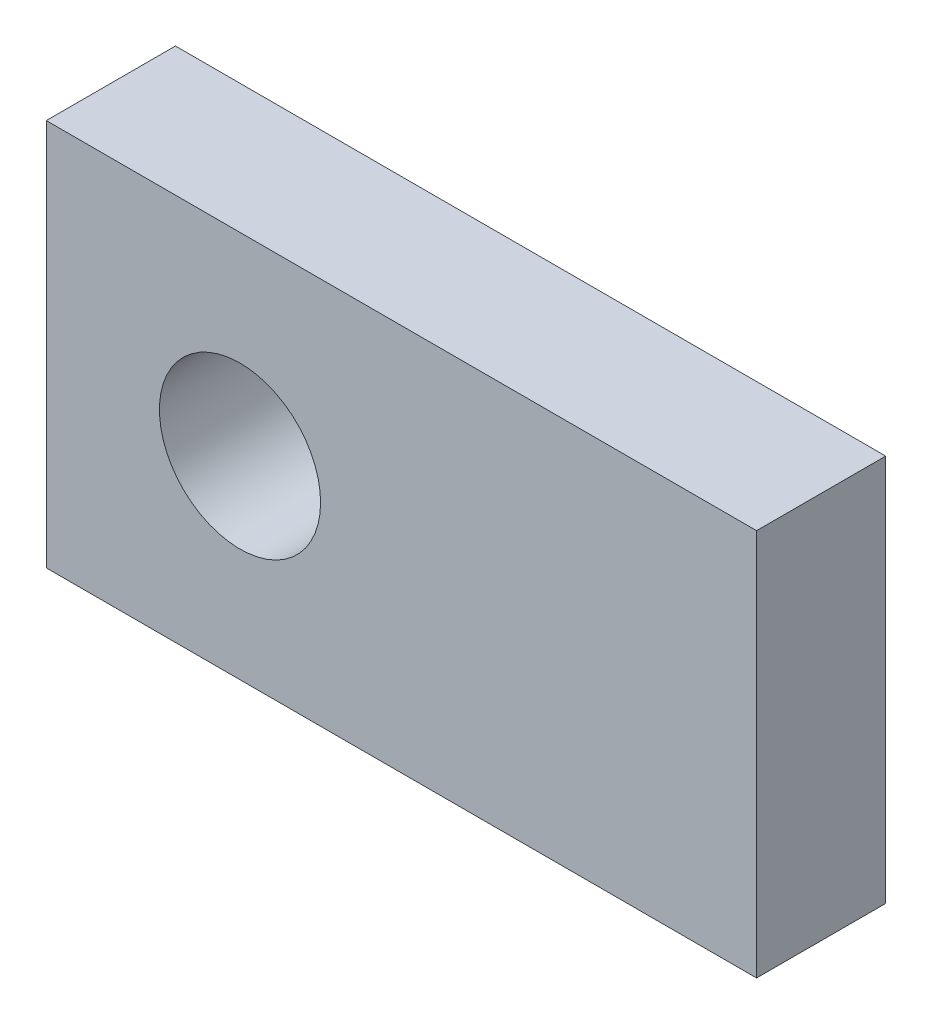
from build123d import *

# Parameters (mm, degrees)
SKETCH1_W           = 34.925
SKETCH1_H           = 19.05
SKETCH1_R           = 3.9624
BOSS_EXTRUDE1_DEPTH = 6.35


with BuildPart() as part:
    # Sketch1 → Boss-Extrude1 (new body)
    with BuildSketch(Plane.XY):
        Rectangle(SKETCH1_W, SKETCH1_H)
        with Locations((-7.9375, 0)):
            Circle(SKETCH1_R, mode=Mode.SUBTRACT)
    extrude(amount=BOSS_EXTRUDE1_DEPTH)


solid = part.part
